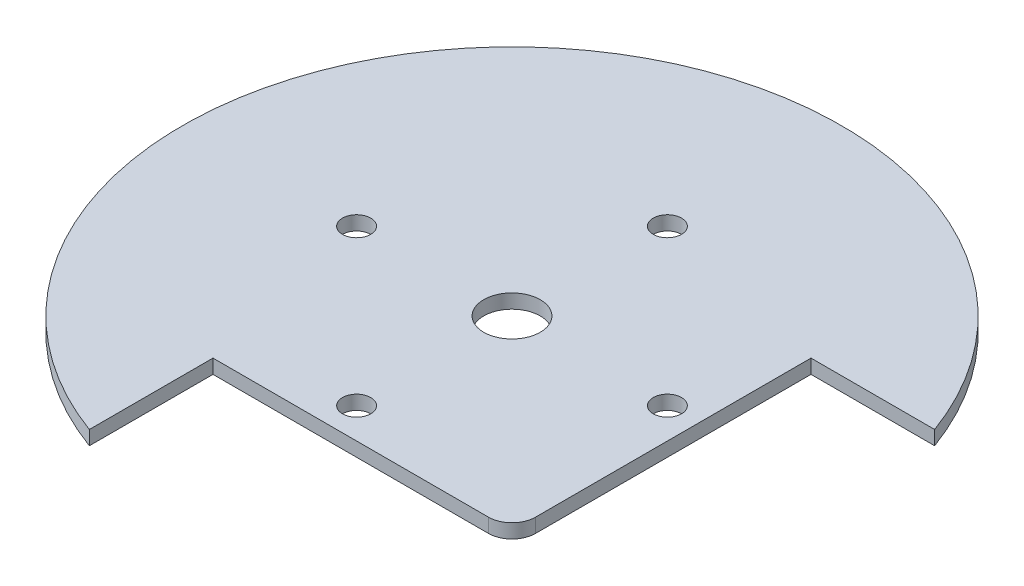
from build123d import *

# Parameters (mm, degrees)
SKETCH1_R           = 6
SKETCH1_R_2         = 3
BOSS_EXTRUDE1_DEPTH = 3


with BuildPart() as part:
    # Sketch1 → Boss-Extrude1 (new body)
    with BuildSketch(Plane(origin=(0, 0, 0), x_dir=(1, 0, 0), z_dir=(0, 1, 0))):
        with BuildLine():
            Line((24, -39.5), (34.5, -39.5))
            ThreePointArc((34.5, -39.5), (38.035533906, -38.035533906), (39.5, -34.5))
            Line((39.5, -34.5), (39.5, -24))
            Line((39.5, -24), (39.5, 24))
            Line((39.5, 24), (65.757128891, 24))
            ThreePointArc((65.757128891, 24), (-49.497474683, 49.497474683), (-24, -65.757128891))
            Line((-24, -65.757128891), (-24, -39.5))
            Line((-24, -39.5), (24, -39.5))
        make_face()
        with Locations(Location((0, 0, 0), (0, 0, 270))):
            Circle(SKETCH1_R, mode=Mode.SUBTRACT)
        with Locations(Location((33, 0, 0), (0, 0, 270))):
            Circle(SKETCH1_R_2, mode=Mode.SUBTRACT)
        with Locations(Location((0, -33, 0), (0, 0, 270))):
            Circle(SKETCH1_R_2, mode=Mode.SUBTRACT)
        with Locations(Location((-33, 0, 0), (0, 0, 270))):
            Circle(SKETCH1_R_2, mode=Mode.SUBTRACT)
        with Locations(Location((0, 33, 0), (0, 0, 270))):
            Circle(SKETCH1_R_2, mode=Mode.SUBTRACT)
    extrude(amount=BOSS_EXTRUDE1_DEPTH)


solid = part.part
